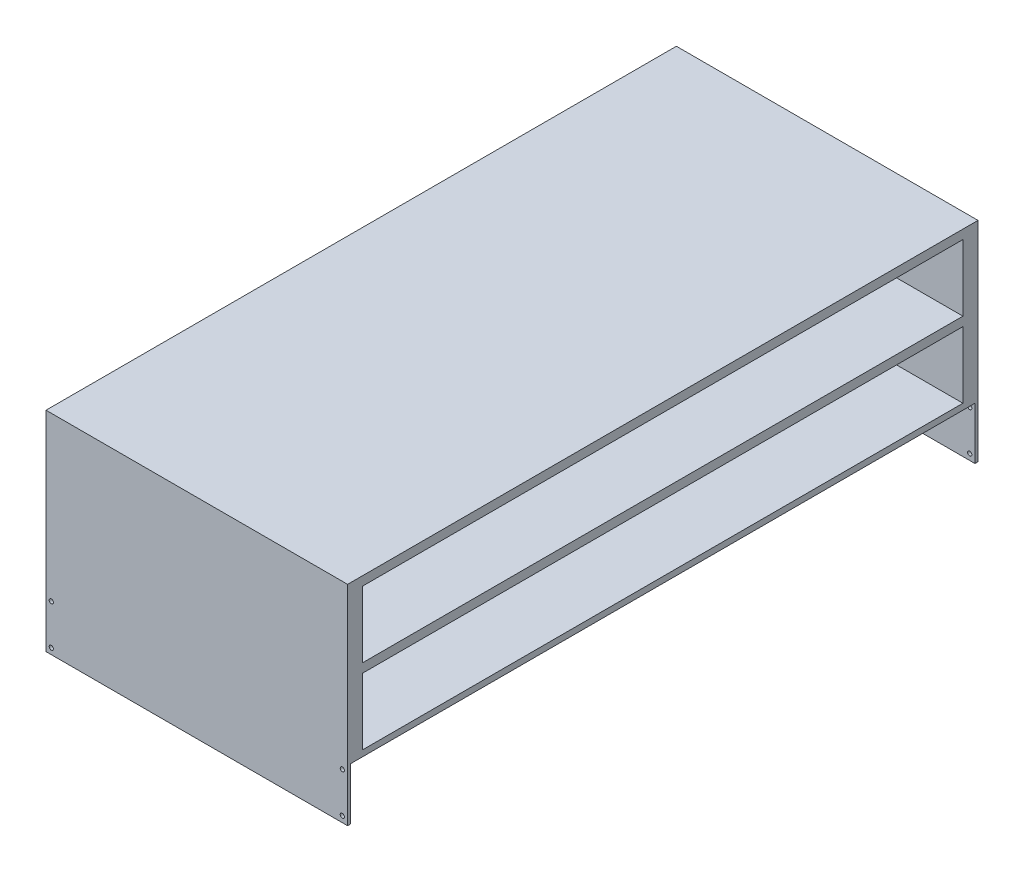
from build123d import *

# Parameters (mm, degrees)
SZKIC1_W                    = 1000
SZKIC1_H                    = 173.21
SZKIC1_R                    = 7
DODANIE_WYCI_GNI_CIE1_DEPTH = 10
SZKIC3_W                    = 1000
SZKIC3_H                    = 10
DODANIE_WYCI_GNI_CIE3_DEPTH = 20
SZKIC4_W                    = 1000
SZKIC4_H                    = 20
DODANIE_WYCI_GNI_CIE4_DEPTH = 2080
SZKIC5_W                    = 1000
SZKIC5_H                    = 50
DODANIE_WYCI_GNI_CIE5_DEPTH = 500
SZKIC6_W                    = 1000
SZKIC6_H                    = 30
DODANIE_WYCI_GNI_CIE6_DEPTH = 1990
SZYK_LINIOWY1_COUNT         = 2
SZYK_LINIOWY1_PITCH         = 250


with BuildPart() as part:
    # Szkic1 → Dodanie-wyciągnięcie1 (new body)
    with BuildSketch(Plane.XY):
        Rectangle(SZKIC1_W, SZKIC1_H)
        with Locations((-482.5, 66.605)):
            Circle(SZKIC1_R, mode=Mode.SUBTRACT)
        with Locations(Location((482.5, 66.605, 0), (0, 0, 180))):
            Circle(SZKIC1_R, mode=Mode.SUBTRACT)
        with Locations(Location((-482.5, -66.605, 0), (0, 0, 180))):
            Circle(SZKIC1_R, mode=Mode.SUBTRACT)
        with Locations((482.5, -66.605)):
            Circle(SZKIC1_R, mode=Mode.SUBTRACT)
    dodanie_wyci_gni_cie1 = extrude(amount=DODANIE_WYCI_GNI_CIE1_DEPTH)

    # Szkic3 → Dodanie-wyciągnięcie3 (add)
    with BuildSketch(Plane(origin=(0, 86.605, 0), x_dir=(1, 0, 0), z_dir=(0, 1, 0))):
        with Locations((0, -5)):
            Rectangle(SZKIC3_W, SZKIC3_H)
    extrude(amount=DODANIE_WYCI_GNI_CIE3_DEPTH)

    # Szkic4 → Dodanie-wyciągnięcie4 (add)
    with BuildSketch(Plane.XY.offset(10)):
        with Locations((0, 96.605)):
            Rectangle(SZKIC4_W, SZKIC4_H)
    extrude(amount=DODANIE_WYCI_GNI_CIE4_DEPTH)

    # Lustro1: Dodanie-wyciągnięcie1 across plane
    add(dodanie_wyci_gni_cie1.mirror(Plane(origin=(0, 0, 1045), x_dir=(1, 0, 0), z_dir=(0, 0, -1))))

    # Szkic5 → Dodanie-wyciągnięcie5 (add)
    with BuildSketch(Plane(origin=(0, 106.605, 0), x_dir=(1, 0, 0), z_dir=(0, 1, 0))):
        with Locations((0, -2065)):
            Rectangle(SZKIC5_W, SZKIC5_H)
        with Locations((0, -25)):
            Rectangle(SZKIC5_W, SZKIC5_H)
    extrude(amount=DODANIE_WYCI_GNI_CIE5_DEPTH)

    # Szkic6 → Dodanie-wyciągnięcie6 (add)
    with BuildSketch(Plane(origin=(0, 0, 2040), x_dir=(-1, 0, 0), z_dir=(0, 0, -1))):
        with Locations((0, 341.605)):
            Rectangle(SZKIC6_W, SZKIC6_H)
    dodanie_wyci_gni_cie6 = extrude(amount=DODANIE_WYCI_GNI_CIE6_DEPTH)

    # Szyk liniowy1: Dodanie-wyciągnięcie6 ×2
    with Locations(*[(0, i * SZYK_LINIOWY1_PITCH, 0) for i in range(1, SZYK_LINIOWY1_COUNT)]):
        add(dodanie_wyci_gni_cie6)


solid = part.part
